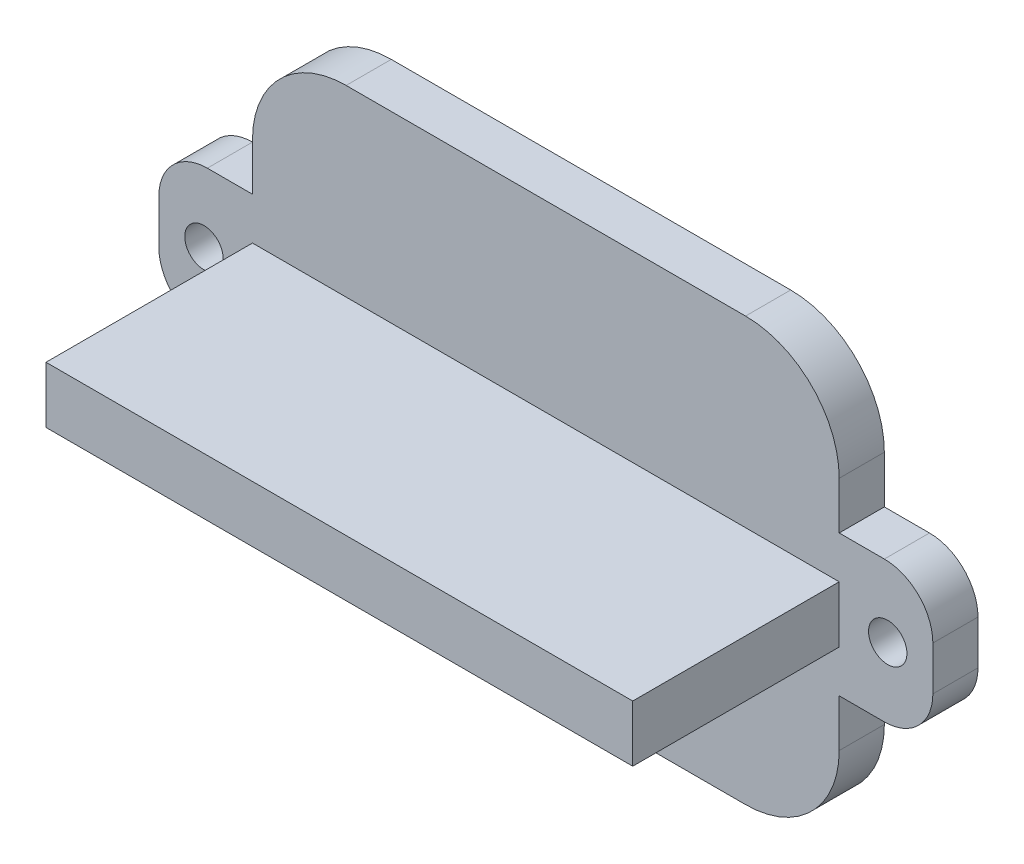
from build123d import *

# Parameters (mm, degrees)
CROQUIS1_R              = 0.85
SALIENTE_EXTRUIR1_DEPTH = 2
CROQUIS2_W              = 26
CROQUIS2_H              = 2.5032448
SALIENTE_EXTRUIR3_DEPTH = 11.15


with BuildPart() as part:
    # Croquis1 → Saliente-Extruir1 (new body)
    # profile 1 of 3: a face of its own
    with BuildSketch(Plane.XY):
        with BuildLine():
            Line((8.85, -9.375), (-8.85, -9.375))
            ThreePointArc((-8.85, -9.375), (-11.784493142, -8.159493142), (-13, -5.225))
            Line((-13, -5.225), (-13, 5.225))
            ThreePointArc((-13, 5.225), (-11.784493142, 8.159493142), (-8.85, 9.375))
            Line((-8.85, 9.375), (8.85, 9.375))
            ThreePointArc((8.85, 9.375), (11.784493142, 8.159493142), (13, 5.225))
            Line((13, 5.225), (13, -5.225))
            ThreePointArc((13, -5.225), (11.784493142, -8.159493142), (8.85, -9.375))
        make_face()
    # profile 2 of 3: a face of its own
    with BuildSketch(Plane.XY):
        with BuildLine():
            Line((-15, -3.125), (-13, -3.125))
            Line((-13, -3.125), (-13, 3.125))
            Line((-13, 3.125), (-15, 3.125))
            ThreePointArc((-15, 3.125), (-16.52027958, 2.49527958), (-17.15, 0.975))
            Line((-17.15, 0.975), (-17.15, -0.975))
            ThreePointArc((-17.15, -0.975), (-16.52027958, -2.49527958), (-15, -3.125))
        make_face()
        with Locations((-15.15, 0)):
            Circle(CROQUIS1_R, mode=Mode.SUBTRACT)
    # profile 3 of 3: a face of its own
    with BuildSketch(Plane.XY):
        with BuildLine():
            Line((13, 3.125), (13, -3.125))
            Line((13, -3.125), (15, -3.125))
            ThreePointArc((15, -3.125), (16.52027958, -2.49527958), (17.15, -0.975))
            Line((17.15, -0.975), (17.15, 0.975))
            ThreePointArc((17.15, 0.975), (16.52027958, 2.49527958), (15, 3.125))
            Line((15, 3.125), (13, 3.125))
        make_face()
        with Locations((15.15, 0)):
            Circle(CROQUIS1_R, mode=Mode.SUBTRACT)
    extrude(amount=SALIENTE_EXTRUIR1_DEPTH)

    # Croquis2 → Saliente-Extruir3 (add)
    with BuildSketch(Plane.XY):
        Rectangle(CROQUIS2_W, CROQUIS2_H)
    extrude(amount=SALIENTE_EXTRUIR3_DEPTH)


solid = part.part
